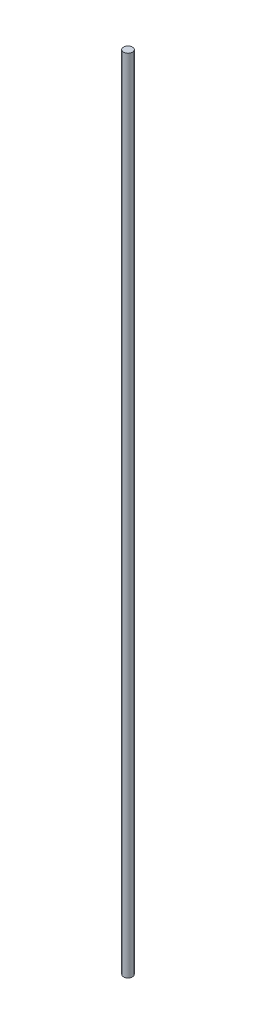
from build123d import *

# Parameters (mm, degrees)
BOSS_EXTRUDE1_DEPTH      = 685.8
BOSS_EXTRUDE1_DEPTH_BACK = 457.2
SKETCH2_R                = 6.35


with BuildPart() as part:
    # Sketch2 → Boss-Extrude1 (new, two sides: drawn at the far end of the back side and taken through both)
    with BuildSketch(Plane(origin=(0, 0, 0), x_dir=(1, 0, 0), z_dir=(0, 1, 0)).offset(-BOSS_EXTRUDE1_DEPTH_BACK)):
        with Locations(Location((0, 0, 0), (0, 0, 270))):
            Circle(SKETCH2_R)
    extrude(amount=BOSS_EXTRUDE1_DEPTH + BOSS_EXTRUDE1_DEPTH_BACK)


solid = part.part
